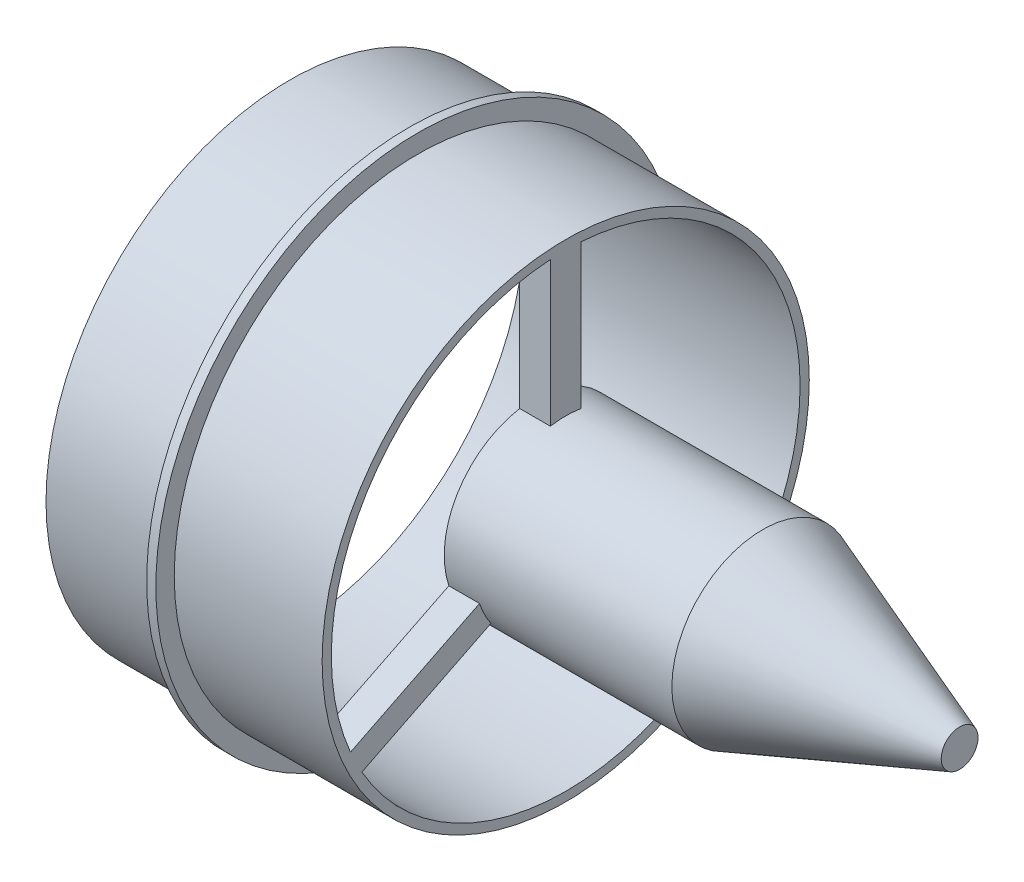
from build123d import *
from build123d.topology import SkipClean

# Parameters (mm, degrees)
SKETCH_1_R          = 39.7
EXTRUDE_1_DEPTH     = 45
SKETCH_2_R          = 38.2
CUT_EXTRUDE_1_DEPTH = 72.952623302
SKETCH_3_R          = 42.7
SKETCH_3_R_2        = 39.7
EXTRUDE_2_DEPTH     = 1.5
EXTRUDE_START       = -5
EXTRUDE_3_DEPTH     = 5
SKETCH_7_R          = 14.8
EXTRUDE_4_DEPTH     = 32.1
SKETCH_9_R          = 14.8
SKETCH_10_R         = 3


with BuildPart() as part:
    # Эскиз1 → Бобышка-Вытянуть1 (new body)
    with BuildSketch(Plane(origin=(0, 0, 0), x_dir=(0, 0, -1), z_dir=(1, 0, 0))):
        with Locations(Location((0, 0, 0), (0, 0, 180))):
            Circle(SKETCH_1_R)
    extrude(amount=EXTRUDE_1_DEPTH)

    # Эскиз2 → Вырез-Вытянуть1 (cut, through all)
    with BuildSketch(Plane.ZY):
        Circle(SKETCH_2_R)
    extrude(amount=-CUT_EXTRUDE_1_DEPTH, mode=Mode.SUBTRACT)

    # Эскиз3 → Бобышка-Вытянуть2 (add)
    with BuildSketch(Plane(origin=(19.4, 0, 0), x_dir=(0, 0, -1), z_dir=(1, 0, 0))):
        Circle(SKETCH_3_R)
        with Locations(Location((0, 0, 0), (0, 0, 180))):
            Circle(SKETCH_3_R_2, mode=Mode.SUBTRACT)
    extrude(amount=EXTRUDE_2_DEPTH)

    # Эскиз6 → Бобышка-Вытянуть3 (add)
    with BuildSketch(Plane(origin=(45, 0, 0), x_dir=(0, 0, -1), z_dir=(1, 0, 0)).offset(EXTRUDE_START)):
        with BuildLine():
            Line((-2.5, 14.587323264), (-2.5, 38.118105934))
            ThreePointArc((-2.5, 38.118105934), (0, 38.2), (2.5, 38.118105934))
            Line((2.5, 38.118105934), (2.5, 14.587323264))
            ThreePointArc((2.5, 14.587323264), (12.69187237, 7.612908495), (14.046441999, -4.662345674))
            Line((14.046441999, -4.662345674), (35.075432195, -15.131227853))
            ThreePointArc((35.075432195, -15.131227853), (34.196736932, -17.024194054), (33.215973901, -18.86634776))
            Line((33.215973901, -18.86634776), (12.186983705, -8.397465581))
            ThreePointArc((12.186983705, -8.397465581), (0, -14.8), (-12.186983705, -8.397465581))
            Line((-12.186983705, -8.397465581), (-33.215973901, -18.86634776))
            ThreePointArc((-33.215973901, -18.86634776), (-34.196736932, -17.024194054), (-35.075432195, -15.131227853))
            Line((-35.075432195, -15.131227853), (-14.046441999, -4.662345674))
            ThreePointArc((-14.046441999, -4.662345674), (-12.69187237, 7.612908495), (-2.5, 14.587323264))
        make_face()
    extrude(amount=EXTRUDE_3_DEPTH)

    # Эскиз7 → Бобышка-Вытянуть4 (add)
    with SkipClean():  # the faces are left unmerged after this step: merging them gives an invalid solid
        with BuildSketch(Plane(origin=(45, 0, 0), x_dir=(0, 0, -1), z_dir=(1, 0, 0))):
            Circle(SKETCH_7_R)
        extrude(amount=EXTRUDE_4_DEPTH)

    # Эскиз9 → По сечениям1 section 0
    with SkipClean():  # the faces are left unmerged after this step: merging them gives an invalid solid
        with BuildSketch(Plane(origin=(77.1, 0, 0), x_dir=(0, 0, -1), z_dir=(1, 0, 0))):
            Circle(SKETCH_9_R)
        # Эскиз10 → По сечениям1 section 1
        with BuildSketch(Plane(origin=(109.2, 0, 0), x_dir=(0, 0, -1), z_dir=(1, 0, 0))):
            Circle(SKETCH_10_R)
        loft()


solid = part.part
